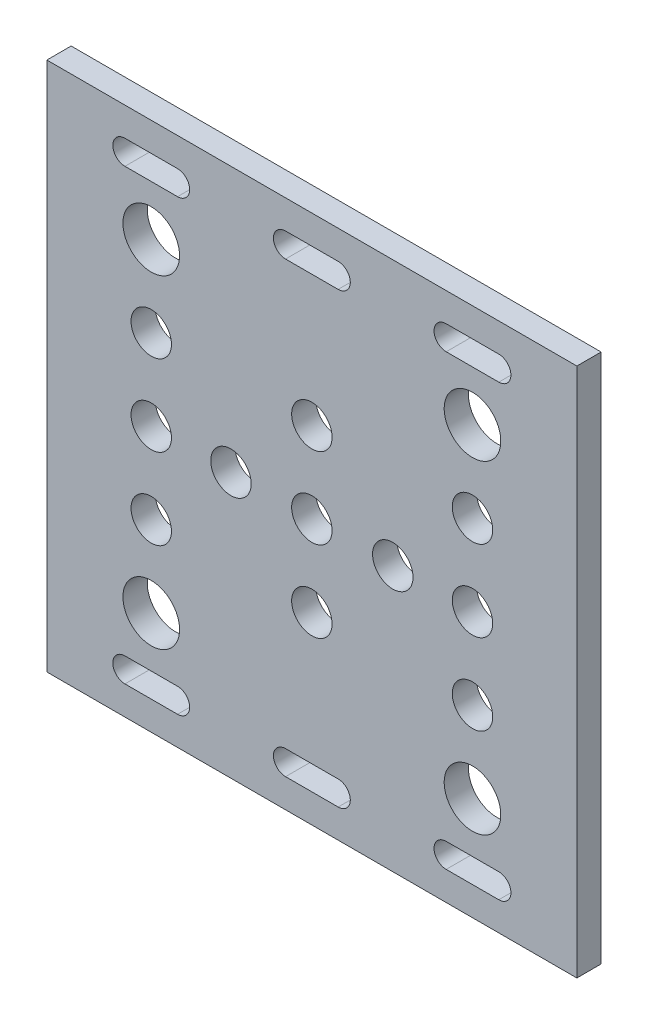
from build123d import *

# Parameters (mm, degrees)
SKETCH1_W           = 65.5
SKETCH1_H           = 65.5
SKETCH1_R           = 3.5
SKETCH1_R_2         = 2.5
BOSS_EXTRUDE1_DEPTH = 3


with BuildPart() as part:
    # Sketch1 → Boss-Extrude1 (new body)
    with BuildSketch(Plane.XY):
        Rectangle(SKETCH1_W, SKETCH1_H)
        with Locations((-19.85, 20)):
            Circle(SKETCH1_R, mode=Mode.SUBTRACT)
        with Locations((-19.85, 10)):
            Circle(SKETCH1_R_2, mode=Mode.SUBTRACT)
        with Locations((-19.85, 0)):
            Circle(SKETCH1_R_2, mode=Mode.SUBTRACT)
        with Locations((-19.85, -10)):
            Circle(SKETCH1_R_2, mode=Mode.SUBTRACT)
        with Locations((-19.85, -20)):
            Circle(SKETCH1_R, mode=Mode.SUBTRACT)
        with Locations(Location((19.85, -20, 0), (0, 0, 180))):
            Circle(SKETCH1_R, mode=Mode.SUBTRACT)
        with Locations(Location((19.85, -10, 0), (0, 0, 180))):
            Circle(SKETCH1_R_2, mode=Mode.SUBTRACT)
        with Locations(Location((19.85, 0, 0), (0, 0, 180))):
            Circle(SKETCH1_R_2, mode=Mode.SUBTRACT)
        with Locations(Location((19.85, 10, 0), (0, 0, 180))):
            Circle(SKETCH1_R_2, mode=Mode.SUBTRACT)
        with Locations(Location((19.85, 20, 0), (0, 0, 180))):
            Circle(SKETCH1_R, mode=Mode.SUBTRACT)
        Circle(SKETCH1_R_2, mode=Mode.SUBTRACT)
        with Locations((10, 0)):
            Circle(SKETCH1_R_2, mode=Mode.SUBTRACT)
        with Locations((-10, 0)):
            Circle(SKETCH1_R_2, mode=Mode.SUBTRACT)
        with Locations((0, 10)):
            Circle(SKETCH1_R_2, mode=Mode.SUBTRACT)
        with Locations((0, -10)):
            Circle(SKETCH1_R_2, mode=Mode.SUBTRACT)
        with BuildLine():
            Line((-23.1, 29.2), (-16.6, 29.2))
            ThreePointArc((-16.6, 29.2), (-15.1, 27.7), (-16.6, 26.2))
            Line((-16.6, 26.2), (-23.1, 26.2))
            ThreePointArc((-23.1, 26.2), (-24.6, 27.7), (-23.1, 29.2))
        make_face(mode=Mode.SUBTRACT)
        with BuildLine():
            Line((-23.1, -26.2), (-16.6, -26.2))
            ThreePointArc((-16.6, -26.2), (-15.1, -27.7), (-16.6, -29.2))
            Line((-16.6, -29.2), (-23.1, -29.2))
            ThreePointArc((-23.1, -29.2), (-24.6, -27.7), (-23.1, -26.2))
        make_face(mode=Mode.SUBTRACT)
        with BuildLine():
            Line((-3.25, 29.2), (3.25, 29.2))
            ThreePointArc((3.25, 29.2), (4.75, 27.7), (3.25, 26.2))
            Line((3.25, 26.2), (-3.25, 26.2))
            ThreePointArc((-3.25, 26.2), (-4.75, 27.7), (-3.25, 29.2))
        make_face(mode=Mode.SUBTRACT)
        with BuildLine():
            Line((-3.25, -29.2), (3.25, -29.2))
            ThreePointArc((3.25, -29.2), (4.75, -27.7), (3.25, -26.2))
            Line((3.25, -26.2), (-3.25, -26.2))
            ThreePointArc((-3.25, -26.2), (-4.75, -27.7), (-3.25, -29.2))
        make_face(mode=Mode.SUBTRACT)
        with BuildLine():
            Line((23.1, -26.2), (16.6, -26.2))
            ThreePointArc((16.6, -26.2), (15.1, -27.7), (16.6, -29.2))
            Line((16.6, -29.2), (23.1, -29.2))
            ThreePointArc((23.1, -29.2), (24.6, -27.7), (23.1, -26.2))
        make_face(mode=Mode.SUBTRACT)
        with BuildLine():
            Line((23.1, 29.2), (16.6, 29.2))
            ThreePointArc((16.6, 29.2), (15.1, 27.7), (16.6, 26.2))
            Line((16.6, 26.2), (23.1, 26.2))
            ThreePointArc((23.1, 26.2), (24.6, 27.7), (23.1, 29.2))
        make_face(mode=Mode.SUBTRACT)
    extrude(amount=BOSS_EXTRUDE1_DEPTH)


solid = part.part
